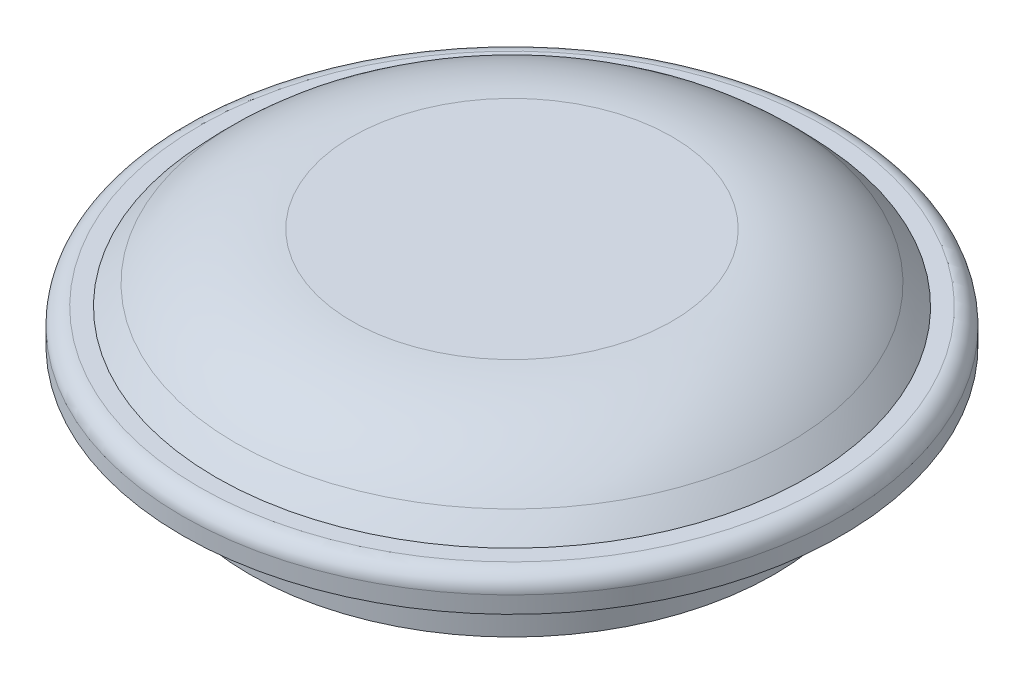
from build123d import *

# Parameters (mm, degrees)
SKETCH1_R               = 9.926666649
BOSS_EXTRUDE1_DEPTH     = 2.54
SKETCH2_R               = 12.466666649
BOSS_EXTRUDE2_DEPTH     = 1.27
FILLET1_R               = 0.635
CUT_EXTRUDE1_DEPTH      = 20.718919442
CUT_EXTRUDE1_DEPTH_BACK = 20.718919442
SKETCH4_W               = 27.24769987
SKETCH4_H               = 6.35
FILLET2_R               = 6.35


with BuildPart() as part:
    # Sketch1 → Boss-Extrude1 (new body)
    with BuildSketch(Plane(origin=(0, 0, 0), x_dir=(1, 0, 0), z_dir=(0, 1, 0))):
        with Locations(Location((0, 0, 0), (0, 0, 270))):
            Circle(SKETCH1_R)
    extrude(amount=BOSS_EXTRUDE1_DEPTH)

    # Sketch2 → Boss-Extrude2 (add)
    with BuildSketch(Plane(origin=(0, 2.54, 0), x_dir=(1, 0, 0), z_dir=(0, 1, 0))):
        with Locations(Location((0, 0, 0), (0, 0, 270))):
            Circle(SKETCH2_R)
    extrude(amount=BOSS_EXTRUDE2_DEPTH)

    # Sketch3 → Revolve1 (revolve)
    with BuildSketch(Plane.XY):
        with BuildLine():
            Line((0, 8.831773608), (0, 3.81))
            Line((0, 3.81), (-11.196666649, 3.81))
            ThreePointArc((-11.196666649, 3.81), (-6.127083682, 7.49980126), (0, 8.831773608))
        make_face()
    revolve(axis=Axis((0, 8.831773608, 0), (0, -1, 0)))

    # Fillet1
    fillet1_edges = [part.edges().sort_by_distance(p)[0] for p in [
        (0, 3.81, -12.466666649),
    ]]
    fillet(fillet1_edges, radius=FILLET1_R)

    # Sketch4 → Cut-Extrude1 (cut, two sides: drawn at the far end of the back side and taken through both)
    with BuildSketch(Plane.XY.offset(-CUT_EXTRUDE1_DEPTH_BACK)):
        with Locations((-1.310749411, 9.525)):
            Rectangle(SKETCH4_W, SKETCH4_H)
    extrude(amount=CUT_EXTRUDE1_DEPTH + CUT_EXTRUDE1_DEPTH_BACK, mode=Mode.SUBTRACT)

    # Fillet2
    fillet2_edges = [part.edges().sort_by_distance(p)[0] for p in [
        (8.22955279, 6.35, -5e-09),
    ]]
    fillet(fillet2_edges, radius=FILLET2_R)


solid = part.part
